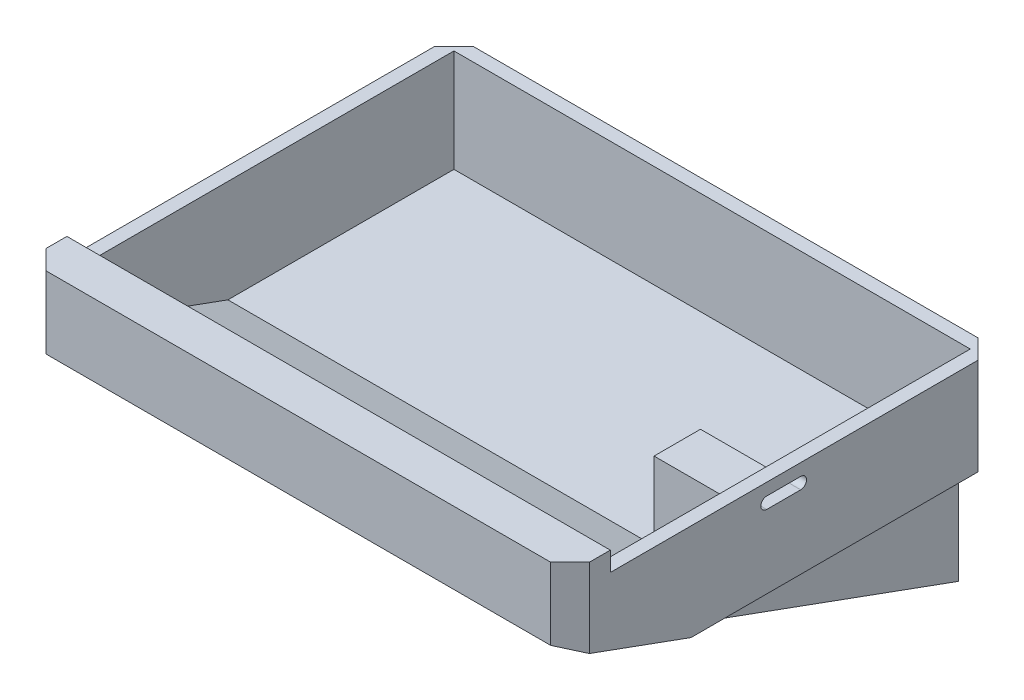
from build123d import *
from OCP.BRepFilletAPI import BRepFilletAPI_MakeChamfer

# Parameters (mm, degrees)
SKETCH1_W           = 140.4
SKETCH1_H           = 110.4
BOSS_EXTRUDE1_DEPTH = 30
SHELL1_T            = -3.5
SKETCH2_W           = 140.4
SKETCH2_H           = 10.4
BOSS_EXTRUDE2_DEPTH = 5
CUT_EXTRUDE3_DEPTH  = 5
SKETCH5_W           = 12
SKETCH5_H           = 19.4
BOSS_EXTRUDE3_DEPTH = 24
CHAMFER1_SIZE       = 45
CHAMFER1_SIZE2      = 16.378660542
CHAMFER3_SIZE       = 5
BOSS_EXTRUDE5_DEPTH = 5


with BuildPart() as part:
    # Sketch1 → Boss-Extrude1 (new body)
    with BuildSketch(Plane(origin=(0, 0, 0), x_dir=(1, 0, 0), z_dir=(0, 1, 0))):
        Rectangle(SKETCH1_W, SKETCH1_H)
    extrude(amount=-BOSS_EXTRUDE1_DEPTH)

    # Shell1
    shell1_openings = [part.faces().sort_by_distance(p)[0] for p in [
        (0, 0, 0),
    ]]
    offset(amount=SHELL1_T, openings=shell1_openings, kind=Kind.INTERSECTION)

    # Sketch2 → Boss-Extrude2 (add)
    with BuildSketch(Plane(origin=(0, 0, 0), x_dir=(1, 0, 0), z_dir=(0, 1, 0))):
        with Locations((0, -50)):
            Rectangle(SKETCH2_W, SKETCH2_H)
    extrude(amount=BOSS_EXTRUDE2_DEPTH)

    # Sketch6 → Cut-Extrude3 (cut)
    with BuildSketch(Plane.ZY.offset(-66.7)):
        with BuildLine():
            Line((-4.4, -3.1), (4.4, -3.1))
            ThreePointArc((4.4, -3.1), (5.9, -4.6), (4.4, -6.1))
            Line((4.4, -6.1), (-4.4, -6.1))
            ThreePointArc((-4.4, -6.1), (-5.9, -4.6), (-4.4, -3.1))
        make_face()
    extrude(amount=-CUT_EXTRUDE3_DEPTH, mode=Mode.SUBTRACT)

    # Sketch5 → Boss-Extrude3 (add)
    with BuildSketch(Plane.ZY.offset(-66.7)):
        with Locations((0, -16.8)):
            Rectangle(SKETCH5_W, SKETCH5_H)
    extrude(amount=BOSS_EXTRUDE3_DEPTH)

    # Chamfer1: one chamfer whose edges measure the first distance from different faces: ONE call of the kernel's chamfer builder (chamfer() names one face for all edges)
    chamfer1_edges_1 = [part.edges().sort_by_distance(p)[0] for p in [
        (0, -26.5, 51.7),
    ]]
    chamfer1_side_1 = [part.faces().sort_by_distance(p)[0] for p in [
        (-1.166452928, -26.5, 0),
    ]]
    chamfer1_edges_2 = [part.edges().sort_by_distance(p)[0] for p in [
        (0, -30, 55.2),
    ]]
    chamfer1_side_2 = [part.faces().sort_by_distance(p)[0] for p in [
        (0, -30, 0),
    ]]
    chamfer1 = BRepFilletAPI_MakeChamfer(part.part.solid().wrapped)
    for e in chamfer1_edges_1:
        chamfer1.Add(CHAMFER1_SIZE, CHAMFER1_SIZE2, e.wrapped, chamfer1_side_1[0].wrapped)  # the first distance lies on this face
    for e in chamfer1_edges_2:
        chamfer1.Add(CHAMFER1_SIZE, CHAMFER1_SIZE2, e.wrapped, chamfer1_side_2[0].wrapped)  # the first distance lies on this face
    add(Compound.cast(chamfer1.Shape()), mode=Mode.REPLACE)

    # Chamfer3
    chamfer3_edges = [part.edges().sort_by_distance(p)[0] for p in [
        (-70.2, -30, -22.5),
        (-70.2, -15, -55.2),
        (70.2, -15, -55.2),
        (70.2, -4.310669729, 55.2),
        (-70.2, -4.310669729, 55.2),
        (70.2, -30, -22.5),
        (0, -30, -55.2),
    ]]
    chamfer(chamfer3_edges, length=CHAMFER3_SIZE)

    # Sketch10 → Boss-Extrude5 (add)
    with BuildSketch(Plane(origin=(65.2, 0, 0), x_dir=(0, 0, 1), z_dir=(1, 0, 0))):
        Polygon((-50.2, 30), (10.2, 30), (-50.2, 51.98380215), align=None)
    boss_extrude5 = extrude(amount=-BOSS_EXTRUDE5_DEPTH)

    # Mirror1: Boss-Extrude5 across plane
    add(boss_extrude5.mirror(Plane(origin=(0, 0, 0), x_dir=(0, 0, 1), z_dir=(1, 0, 0))))


solid = part.part
